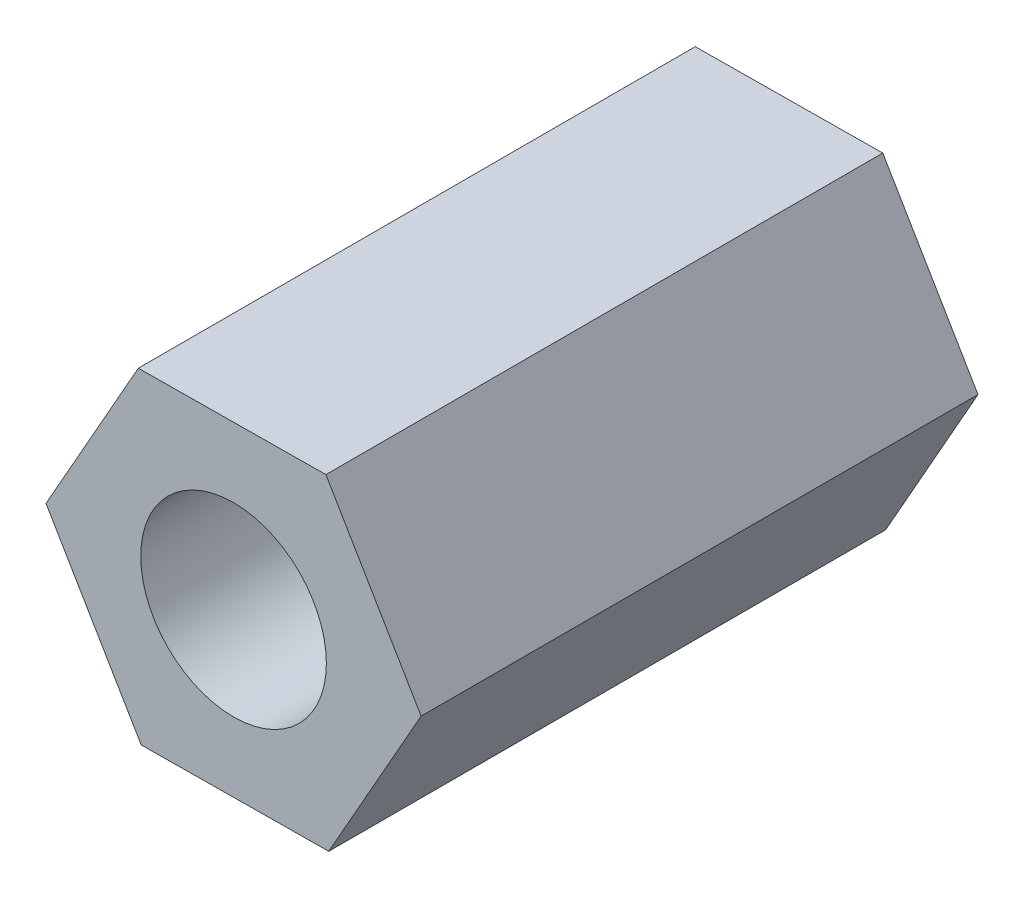
from build123d import *

# Parameters (mm, degrees)
SKETCH_1_R      = 2
EXTRUDE_1_DEPTH = 12


with BuildPart() as part:
    # 草图1 → 凸台-拉伸1 (new body)
    with BuildSketch(Plane.XY):
        Polygon((2.051456248, -3.482077052), (4.041295309, 0.035574699), (1.989839061, 3.517651751), (-2.051456248, 3.482077052), (-4.041295309, -0.035574699), (-1.989839061, -3.517651751), align=None)
        Circle(SKETCH_1_R, mode=Mode.SUBTRACT)
    extrude(amount=EXTRUDE_1_DEPTH)


solid = part.part
